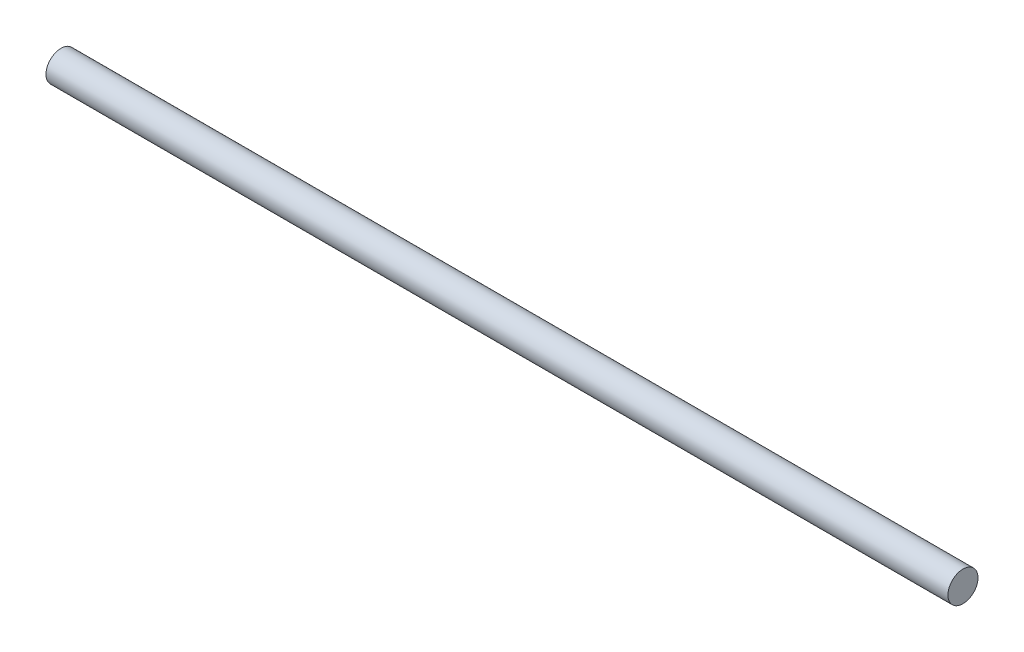
from build123d import *

# Parameters (mm, degrees)
SKETCH1_R           = 10
BOSS_EXTRUDE1_DEPTH = 600


with BuildPart() as part:
    # Sketch1 → Boss-Extrude1 (new body)
    with BuildSketch(Plane.YZ):
        with Locations(Location((0, 0, 0), (0, 0, 270))):
            Circle(SKETCH1_R)
    extrude(amount=BOSS_EXTRUDE1_DEPTH)


solid = part.part
